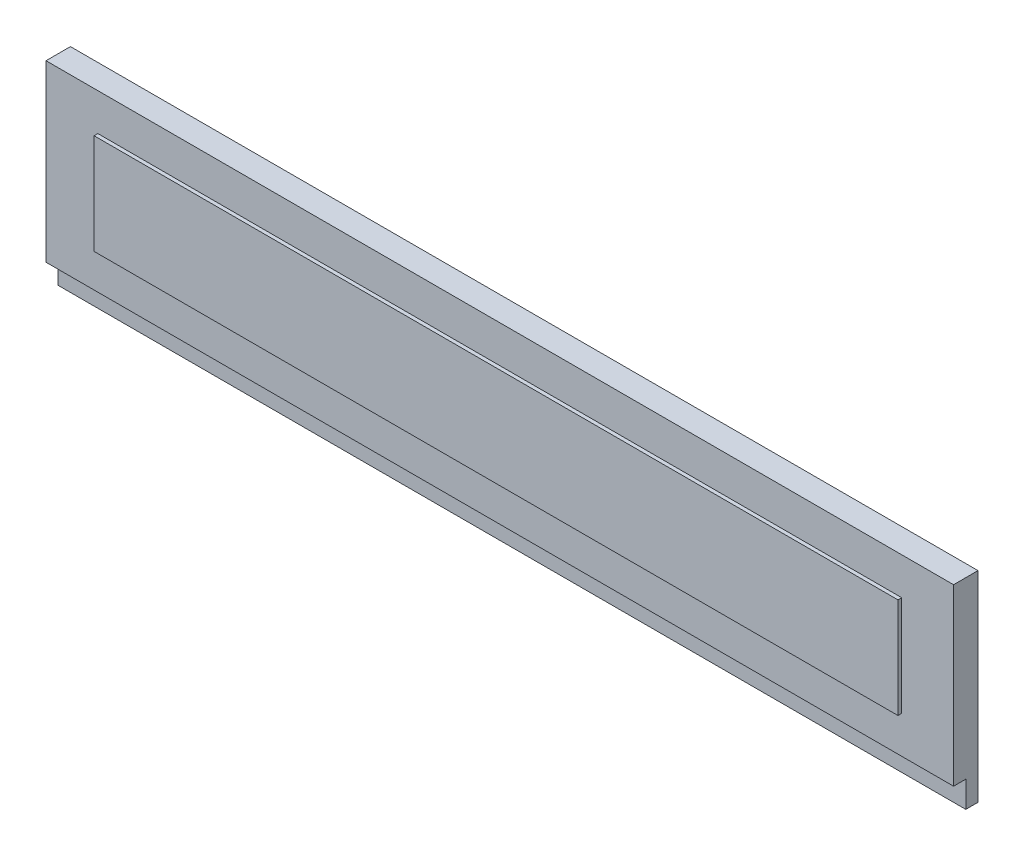
from build123d import *

# Parameters (mm, degrees)
SKETCH1_W           = 52
SKETCH1_H           = 11.5
BOSS_EXTRUDE1_DEPTH = 0.7
SKETCH2_W           = 52
SKETCH2_H           = 10
BOSS_EXTRUDE2_DEPTH = 0.7
SKETCH3_W           = 46.06
SKETCH3_H           = 5.74
BOSS_EXTRUDE3_DEPTH = 0.215
SKETCH4_W           = 51
SKETCH4_H           = 8.5
BOSS_EXTRUDE4_DEPTH = 0.215


with BuildPart() as part:
    # Sketch1 → Boss-Extrude1 (new body)
    with BuildSketch(Plane.XY):
        Rectangle(SKETCH1_W, SKETCH1_H)
    extrude(amount=BOSS_EXTRUDE1_DEPTH)

    # Sketch2 → Boss-Extrude2 (add)
    with BuildSketch(Plane.XY.offset(0.7)):
        with Locations((0, 0.75)):
            Rectangle(SKETCH2_W, SKETCH2_H)
    extrude(amount=BOSS_EXTRUDE2_DEPTH)

    # Sketch3 → Boss-Extrude3 (add)
    with BuildSketch(Plane.XY.offset(1.4)):
        with Locations((0, 0.75)):
            Rectangle(SKETCH3_W, SKETCH3_H)
    extrude(amount=BOSS_EXTRUDE3_DEPTH)

    # Sketch4 → Boss-Extrude4 (add)
    with BuildSketch(Plane(origin=(0, 0, 0), x_dir=(-1, 0, 0), z_dir=(0, 0, -1))):
        with Locations((0, 0.75)):
            Rectangle(SKETCH4_W, SKETCH4_H)
    extrude(amount=BOSS_EXTRUDE4_DEPTH)


solid = part.part
